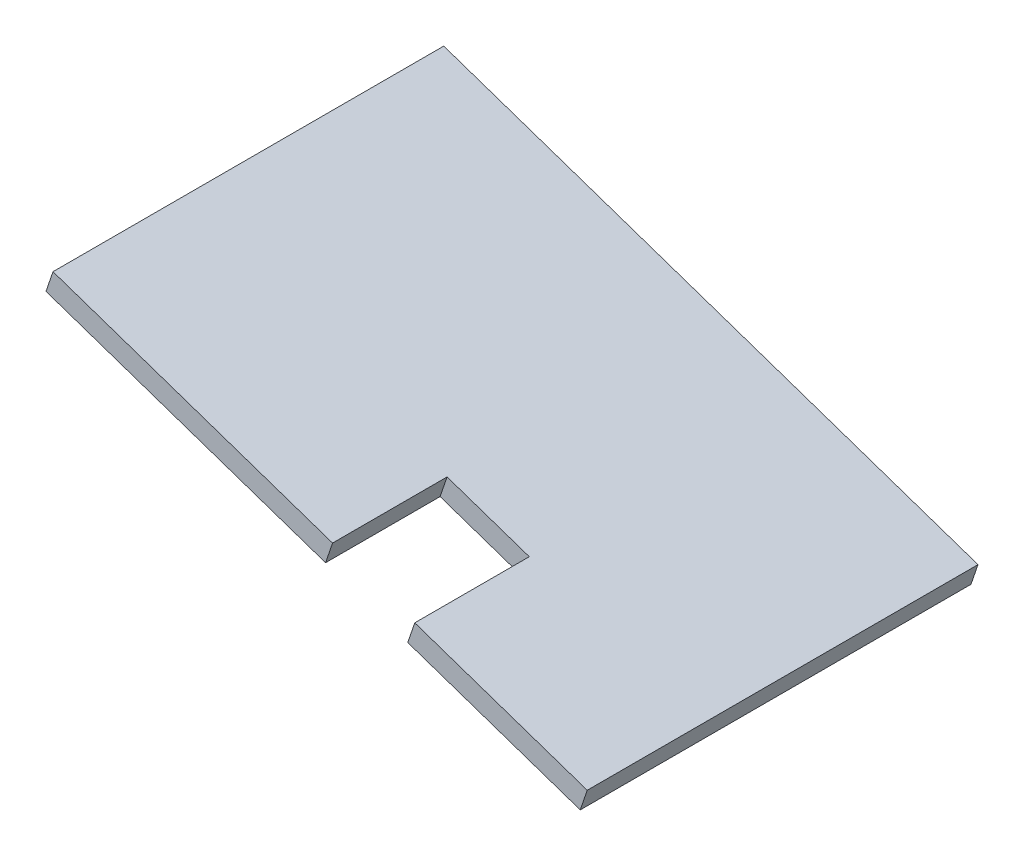
from build123d import *

# Parameters (mm, degrees)
BOSS_EXTRUDE2_DEPTH = 114.3
CUT_EXTRUDE1_REACH  = 541.354
SKETCH2_W           = 25.4
SKETCH2_H           = 40.79687197


with BuildPart() as part:
    # Sketch1 → Boss-Extrude2 (new body)
    with BuildSketch(Plane.XY):
        Polygon((581.808782497, 79.428009058), (425.537875129, 132.65163668), (423.490637562, 126.640703446), (579.76154493, 73.417075823), align=None)
    extrude(amount=-BOSS_EXTRUDE2_DEPTH)

    # Sketch2 → Cut-Extrude1 (cut, up to next)
    with BuildSketch(Plane(origin=(84.714294761, 248.731255285, 0), x_dir=(0.9466036589314765, -0.3223996167763558, 0), z_dir=(0.32239961677635576, 0.9466036589314764, 0)), mode=Mode.PRIVATE) as cut_extrude1_sk1:
        with Locations((459.137216198, 13.100047516)):
            Rectangle(SKETCH2_W, SKETCH2_H)
    cut_extrude1_tool1 = extrude(cut_extrude1_sk1.sketch, amount=-CUT_EXTRUDE1_REACH, mode=Mode.PRIVATE) & part.part
    add(cut_extrude1_tool1.solids().sort_by_distance((519.335264, 100.705593, -13.100048))[0], mode=Mode.SUBTRACT)


solid = part.part
